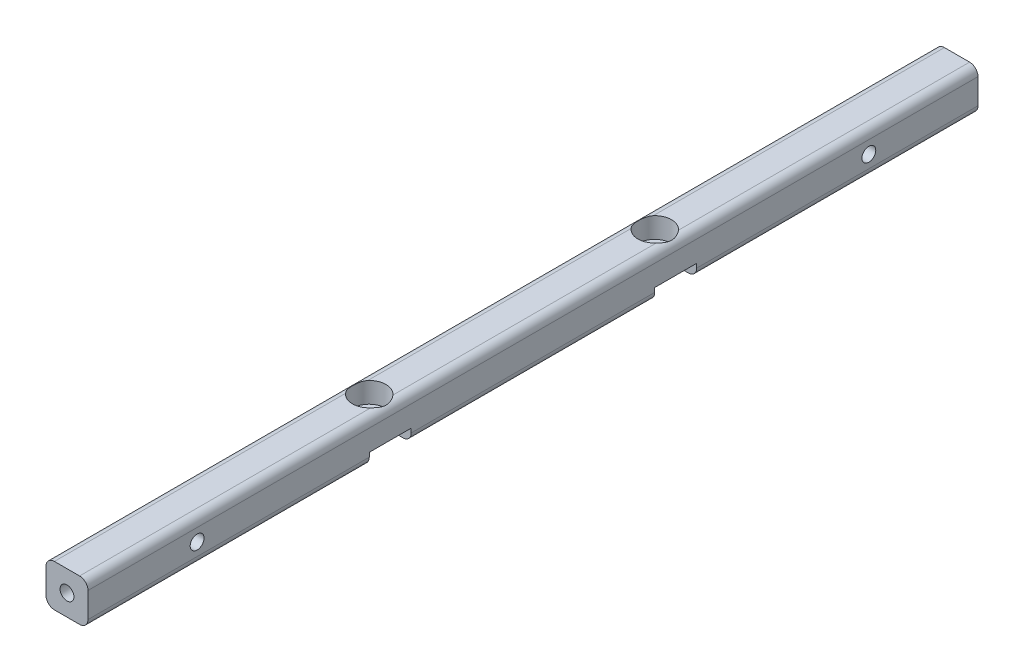
from build123d import *

# Parameters (mm, degrees)
ESQUISSE1_W                                        = 10
ESQUISSE1_H                                        = 10
BOSS_EXTRU_1_DEPTH                                 = 106
TROU_TARAUD_M41_D                                  = 3.3
TROU_TARAUD_M41_DEPTH                              = 11.5
TROU_TARAUD_M41_TIP                                = 0.991420021
TROU_TARAUD_M42_D                                  = 3.3
TROU_TARAUD_M42_DEPTH                              = 11.5
TROU_TARAUD_M42_TIP                                = 0.991420021
CONG_1_R                                           = 2
CHAMBRAGE_POUR_VIS_T_TE_HEXAGONALE_M41_D           = 4.3
CHAMBRAGE_POUR_VIS_T_TE_HEXAGONALE_M41_CBORE_D     = 8
CHAMBRAGE_POUR_VIS_T_TE_HEXAGONALE_M41_CBORE_DEPTH = 4.9
ENL_V_MAT_EXTRU_1_REACH                            = 108.588
ESQUISSE8_W                                        = 10
ESQUISSE8_H                                        = 8
TROU_TARAUD_M44_D                                  = 3.3


with BuildPart() as part:
    # Esquisse1 → Boss.-Extru.1 (new, symmetric)
    with BuildSketch(Plane.XY):
        Rectangle(ESQUISSE1_W, ESQUISSE1_H)
    extrude(amount=BOSS_EXTRU_1_DEPTH, both=True)

    # Trou taraudé M41
    with Locations(Plane.XY.offset(106)):
        with Locations((0, 0)):
            Hole(TROU_TARAUD_M41_D / 2, depth=TROU_TARAUD_M41_DEPTH)
            with Locations((0, 0, -(TROU_TARAUD_M41_DEPTH + TROU_TARAUD_M41_TIP / 2))):  # 118° drill point
                Cone(0, TROU_TARAUD_M41_D / 2, TROU_TARAUD_M41_TIP, mode=Mode.SUBTRACT)

    # Trou taraudé M42
    with Locations(Plane(origin=(0, 0, -106), x_dir=(-1, 0, 0), z_dir=(0, 0, -1))):
        with Locations((0, 0)):
            Hole(TROU_TARAUD_M42_D / 2, depth=TROU_TARAUD_M42_DEPTH)
            with Locations((0, 0, -(TROU_TARAUD_M42_DEPTH + TROU_TARAUD_M42_TIP / 2))):  # 118° drill point
                Cone(0, TROU_TARAUD_M42_D / 2, TROU_TARAUD_M42_TIP, mode=Mode.SUBTRACT)

    # Congé1
    cong_1_edges = [part.edges().sort_by_distance(p)[0] for p in [
        (-5, 5, 0),
        (5, 5, 0),
        (5, -5, 0),
        (-5, -5, 0),
    ]]
    fillet(cong_1_edges, radius=CONG_1_R)

    # Chambrage pour vis à tête hexagonale M41 (through all)
    with Locations(Plane(origin=(0, 5, 0), x_dir=(1, 0, 0), z_dir=(0, 1, 0))):
        with Locations((0, 34), (0, -34)):
            CounterBoreHole(CHAMBRAGE_POUR_VIS_T_TE_HEXAGONALE_M41_D / 2, CHAMBRAGE_POUR_VIS_T_TE_HEXAGONALE_M41_CBORE_D / 2, CHAMBRAGE_POUR_VIS_T_TE_HEXAGONALE_M41_CBORE_DEPTH)

    # Esquisse8 → Enlèv. mat.-Extru.1 (cut, up to next)
    with BuildSketch(Plane(origin=(5, 0, 0), x_dir=(0, 0, -1), z_dir=(1, 0, 0)), mode=Mode.PRIVATE) as enl_v_mat_extru_1_sk1:
        with Locations((34, -6)):
            Rectangle(ESQUISSE8_W, ESQUISSE8_H)
    enl_v_mat_extru_1_tool1 = extrude(enl_v_mat_extru_1_sk1.sketch, amount=-ENL_V_MAT_EXTRU_1_REACH, mode=Mode.PRIVATE) & part.part
    # Esquisse8 → Enlèv. mat.-Extru.1 (cut, up to next)
    with BuildSketch(Plane(origin=(5, 0, 0), x_dir=(0, 0, -1), z_dir=(1, 0, 0)), mode=Mode.PRIVATE) as enl_v_mat_extru_1_sk2:
        with Locations((-34, -6)):
            Rectangle(ESQUISSE8_W, ESQUISSE8_H)
    enl_v_mat_extru_1_tool2 = extrude(enl_v_mat_extru_1_sk2.sketch, amount=-ENL_V_MAT_EXTRU_1_REACH, mode=Mode.PRIVATE) & part.part
    add(enl_v_mat_extru_1_tool1.solids().sort_by_distance((5, -6, -34))[0], mode=Mode.SUBTRACT)
    add(enl_v_mat_extru_1_tool2.solids().sort_by_distance((5, -6, 34))[0], mode=Mode.SUBTRACT)

    # Trou taraudé M44 (through all)
    with Locations(Plane(origin=(5, 0, 0), x_dir=(0, 0, -1), z_dir=(1, 0, 0))):
        with Locations((-80, 0), (80, 0)):
            Hole(TROU_TARAUD_M44_D / 2)


solid = part.part
